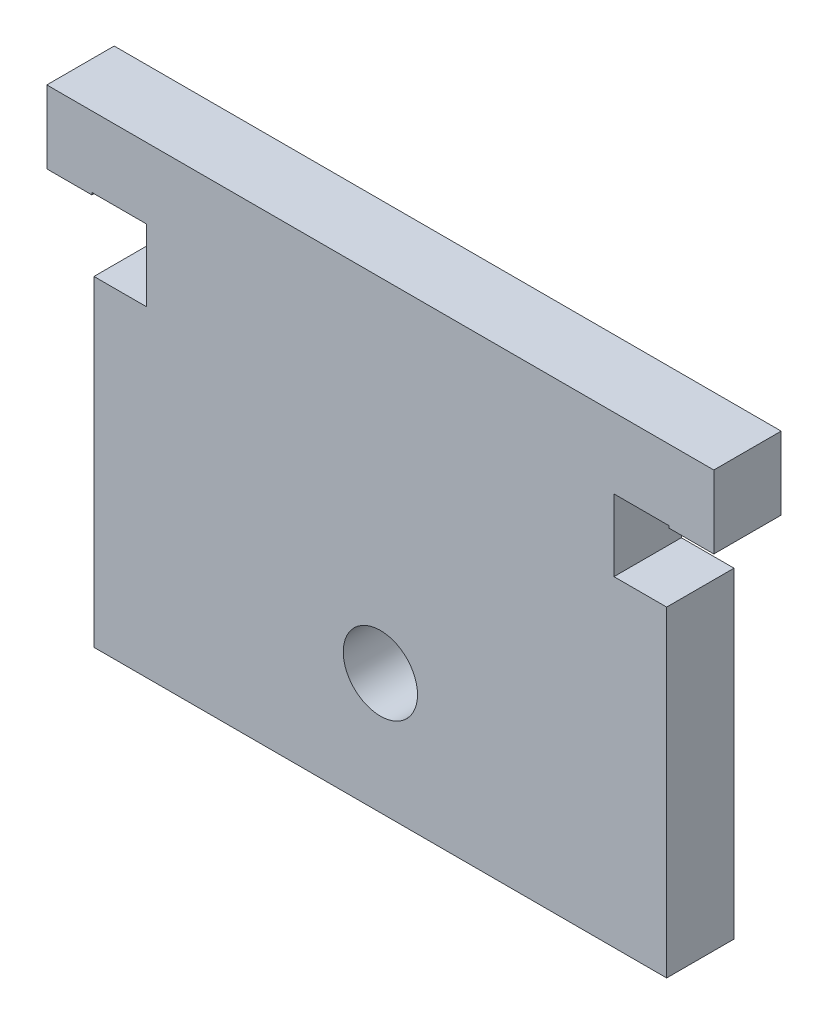
from build123d import *

# Parameters (mm, degrees)
SKETCH1_W            = 85.725
SKETCH1_H            = 50.8
BOSS_EXTRUDE1_DEPTH  = 6.35
SKETCH2_W            = 15.875
SKETCH2_H            = 43.18
CUT_EXTRUDE1_DEPTH   = 6.35
SKETCH3_W            = 85.725
SKETCH3_H            = 6.35
CUT_EXTRUDE2_DEPTH   = 0.762
SKETCH5_W            = 6.35
SKETCH5_H            = 6.35
CUT_EXTRUDE3_DEPTH   = 4.7625
SKETCH7_W            = 6.35
SKETCH7_H            = 6.858
CUT_EXTRUDE5_DEPTH   = 11.43
SKETCH8_W            = 53.975
SKETCH8_H            = 6.35
CUT_EXTRUDE6_DEPTH   = 6.35
M6_CLEARANCE_HOLE1_D = 7
SKETCH12_W           = 5.1689
SKETCH12_H           = 6.7564
CUT_EXTRUDE7_DEPTH   = 41.439530169


with BuildPart() as part:
    # Sketch1 → Boss-Extrude1 (new body)
    with BuildSketch(Plane.XY):
        Rectangle(SKETCH1_W, SKETCH1_H)
    extrude(amount=BOSS_EXTRUDE1_DEPTH)

    # Sketch2 → Cut-Extrude1 (cut)
    with BuildSketch(Plane.XY.offset(6.35)):
        with Locations((-34.925, -3.81)):
            Rectangle(SKETCH2_W, SKETCH2_H)
        with Locations((34.925, -3.81)):
            Rectangle(SKETCH2_W, SKETCH2_H)
    extrude(amount=-CUT_EXTRUDE1_DEPTH, mode=Mode.SUBTRACT)

    # Sketch3 → Cut-Extrude2 (cut)
    with BuildSketch(Plane(origin=(0, 25.4, 0), x_dir=(1, 0, 0), z_dir=(0, 1, 0))):
        with Locations((0, -3.175)):
            Rectangle(SKETCH3_W, SKETCH3_H)
    extrude(amount=-CUT_EXTRUDE2_DEPTH, mode=Mode.SUBTRACT)

    # Sketch5 → Cut-Extrude3 (cut)
    with BuildSketch(Plane.ZY.offset(26.9875)):
        with Locations((3.175, 14.605)):
            Rectangle(SKETCH5_W, SKETCH5_H)
    cut_extrude3 = extrude(amount=-CUT_EXTRUDE3_DEPTH, mode=Mode.SUBTRACT)

    # Mirror1: Cut-Extrude3 across plane
    add(cut_extrude3.mirror(Plane(origin=(0, 0, 0), x_dir=(0, 0, 1), z_dir=(1, 0, 0))), mode=Mode.SUBTRACT)

    # Sketch7 → Cut-Extrude5 (cut)
    with BuildSketch(Plane.ZY.offset(42.8625)):
        with Locations((3.175, 21.209)):
            Rectangle(SKETCH7_W, SKETCH7_H)
    cut_extrude5 = extrude(amount=-CUT_EXTRUDE5_DEPTH, mode=Mode.SUBTRACT)

    # Mirror2: Cut-Extrude5 across plane
    add(cut_extrude5.mirror(Plane(origin=(0, 0, 0), x_dir=(0, 0, 1), z_dir=(1, 0, 0))), mode=Mode.SUBTRACT)

    # Sketch8 → Cut-Extrude6 (cut)
    with BuildSketch(Plane.XZ.offset(25.4)):
        with Locations((0, 3.175)):
            Rectangle(SKETCH8_W, SKETCH8_H)
    extrude(amount=-CUT_EXTRUDE6_DEPTH, mode=Mode.SUBTRACT)

    # M6 Clearance Hole1 (through all)
    with Locations(Plane.XY.offset(6.35)):
        with Locations((0.00592, -7.666260004)):
            Hole(M6_CLEARANCE_HOLE1_D / 2)

    # Sketch12 → Cut-Extrude7 (cut, through all)
    with BuildSketch(Plane.XY.offset(6.35)):
        with Locations((-24.60625, 14.605)):
            Rectangle(SKETCH12_W, SKETCH12_H)
        with Locations((24.60625, 14.605)):
            Rectangle(SKETCH12_W, SKETCH12_H)
    extrude(amount=-CUT_EXTRUDE7_DEPTH, mode=Mode.SUBTRACT)


solid = part.part
